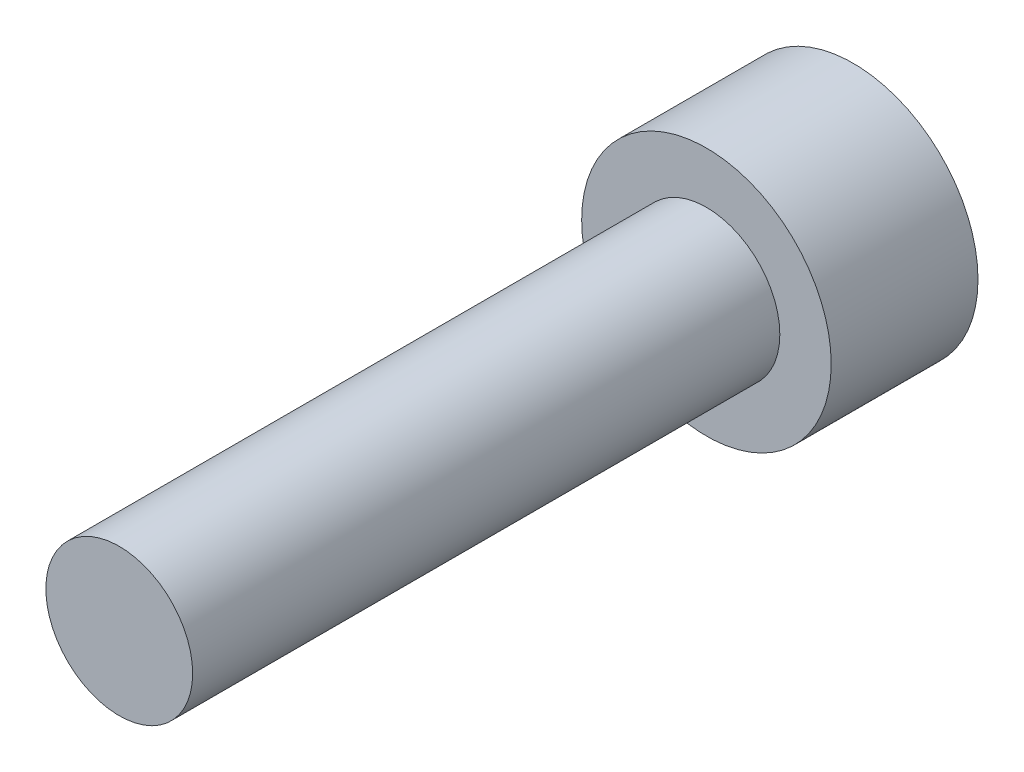
from build123d import *

# Parameters (mm, degrees)
SKETCH_1_R          = 4.25
EXTRUDE_1_DEPTH     = 5
SKETCH_2_R          = 2.5
EXTRUDE_2_DEPTH     = 20
CUT_EXTRUDE_1_DEPTH = 2


with BuildPart() as part:
    # ｽｹｯﾁ1 → ﾎﾞｽ - 押し出し1 (new body)
    with BuildSketch(Plane.XY):
        Circle(SKETCH_1_R)
    extrude(amount=EXTRUDE_1_DEPTH)

    # ｽｹｯﾁ2 → ﾎﾞｽ - 押し出し2 (add)
    with BuildSketch(Plane.XY.offset(5)):
        Circle(SKETCH_2_R)
    extrude(amount=EXTRUDE_2_DEPTH)

    # ｽｹｯﾁ3 → ｶｯﾄ - 押し出し1 (cut)
    with BuildSketch(Plane(origin=(0, 0, 0), x_dir=(-1, 0, 0), z_dir=(0, 0, -1))):
        Polygon((2.481247226, -1.110941893), (2.202727514, 1.593352185), (-0.278519712, 2.704294077), (-2.481247226, 1.110941893), (-2.202727514, -1.593352185), (0.278519712, -2.704294077), align=None)
    extrude(amount=-CUT_EXTRUDE_1_DEPTH, mode=Mode.SUBTRACT)


solid = part.part
